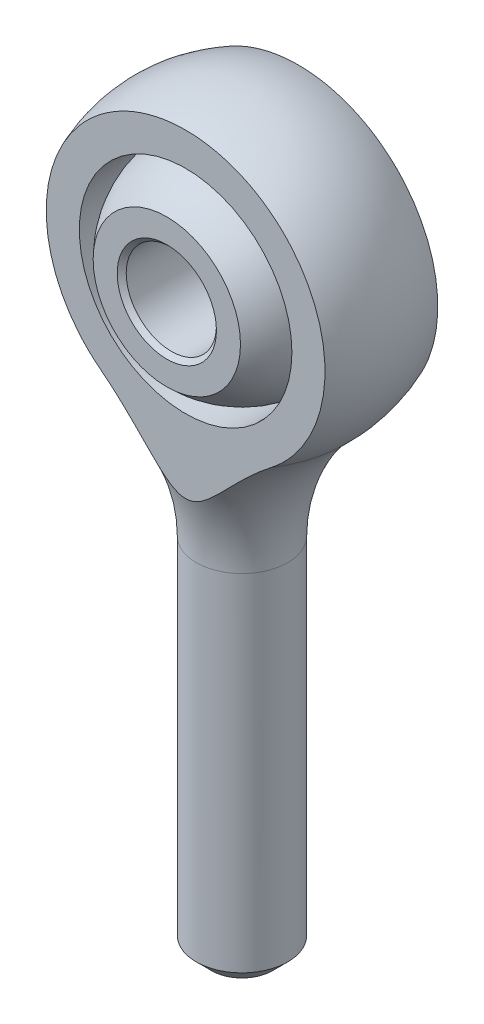
from build123d import *

# Parameters (mm, degrees)
SKETCH1_W               = 2.413
SKETCH1_H               = 19.05
CHAMFER2_SIZE           = 0.79502
CUT_EXTRUDE1_DEPTH      = 24.492854632
CUT_EXTRUDE1_DEPTH_BACK = 24.492854632
CUT_EXTRUDE2_DEPTH      = 23.310765057
CUT_EXTRUDE2_DEPTH_BACK = 23.310765057
SKETCH6_R               = 5.6118125
CUT_EXTRUDE3_DEPTH      = 23.798733003
CUT_EXTRUDE3_DEPTH_BACK = 23.798733003
SKETCH8_W               = 3.96875
SKETCH8_H               = 20.6375
CUT_EXTRUDE4_DEPTH      = 23.798733003
CUT_EXTRUDE4_DEPTH_BACK = 23.798733003
SKETCH10_R              = 2.38125
CHAMFER1_SIZE           = 0.238125


with BuildPart() as part:
    # Sketch1 → Revolve1 (revolve)
    with BuildSketch(Plane.XY):
        with Locations((1.2065, -9.525)):
            Rectangle(SKETCH1_W, SKETCH1_H)
    revolve(axis=Axis((0, 20.6375, 0), (0, -1, 0)))

    # Chamfer2
    chamfer2_edges = [part.edges().sort_by_distance(p)[0] for p in [
        (-2.413, -19.05, 0),
    ]]
    chamfer(chamfer2_edges, length=CHAMFER2_SIZE)

    # Sketch4 → Revolve2 (revolve)
    with BuildSketch(Plane.XY):
        with BuildLine():
            Line((2.413, 0), (0, 0))
            Line((0, 0), (0, 20.6375))
            ThreePointArc((0, 20.6375), (7.385648357, 15.607938203), (5.41152983, 6.893172024))
            ThreePointArc((5.41152983, 6.893172024), (3.195090321, 3.75855696), (2.413, 0))
        make_face()
    revolve(axis=Axis((0, 20.6375, 0), (0, 1, 0)))

    # Sketch5 → Cut-Extrude1 (cut, two sides: drawn at the far end of the back side and taken through both)
    with BuildSketch(Plane(origin=(0, 0, 0), x_dir=(0, 0, -1), z_dir=(1, 0, 0)).offset(-CUT_EXTRUDE1_DEPTH_BACK)):
        Polygon((2.9765625, 20.6375), (7.9375, 20.6375), (7.9375, 0), (2.413, 0), (2.9765625, 1.190625), align=None)
        Polygon((-2.9765625, 20.6375), (-2.9765625, 1.190625), (-2.413, 0), (-7.9375, 0), (-7.9375, 20.6375), align=None)
    extrude(amount=CUT_EXTRUDE1_DEPTH + CUT_EXTRUDE1_DEPTH_BACK, mode=Mode.SUBTRACT)

    # Sketch6 → Cut-Extrude2 (cut, two sides: drawn at the far end of the back side and taken through both)
    with BuildSketch(Plane.XY.offset(-CUT_EXTRUDE2_DEPTH_BACK)):
        with Locations((0, 12.7)):
            Circle(SKETCH6_R)
    extrude(amount=CUT_EXTRUDE2_DEPTH + CUT_EXTRUDE2_DEPTH_BACK, mode=Mode.SUBTRACT)


with BuildPart() as body_2:
    # Sketch7 → Revolve3 (revolve)
    with BuildSketch(Plane.XY):
        with BuildLine():
            Line((0, 18.25625), (0, 7.14375))
            ThreePointArc((0, 7.14375), (5.55625, 12.7), (0, 18.25625))
        make_face()
    revolve(axis=Axis((0, 0, 0), (0, 1, 0)))

    # Sketch8 → Cut-Extrude3 (cut, two sides: drawn at the far end of the back side and taken through both)
    with BuildSketch(Plane(origin=(0, 0, 0), x_dir=(0, 0, -1), z_dir=(1, 0, 0)).offset(-CUT_EXTRUDE3_DEPTH_BACK)):
        with Locations((-5.953125, 10.31875)):
            Rectangle(SKETCH8_W, SKETCH8_H)
        with Locations((5.953125, 10.31875)):
            Rectangle(SKETCH8_W, SKETCH8_H)
    extrude(amount=CUT_EXTRUDE3_DEPTH + CUT_EXTRUDE3_DEPTH_BACK, mode=Mode.SUBTRACT)

    # Sketch10 → Cut-Extrude4 (cut, two sides: drawn at the far end of the back side and taken through both)
    with BuildSketch(Plane.XY.offset(-CUT_EXTRUDE4_DEPTH_BACK)):
        with Locations((0, 12.7)):
            Circle(SKETCH10_R)
    extrude(amount=CUT_EXTRUDE4_DEPTH + CUT_EXTRUDE4_DEPTH_BACK, mode=Mode.SUBTRACT)

    # Chamfer1
    chamfer1_edges = [body_2.edges().sort_by_distance(p)[0] for p in [
        (-2.38125, 12.7, -3.96875),
        (-2.38125, 12.7, 3.96875),
    ]]
    chamfer(chamfer1_edges, length=CHAMFER1_SIZE)


solid = Compound([part.part, body_2.part])
